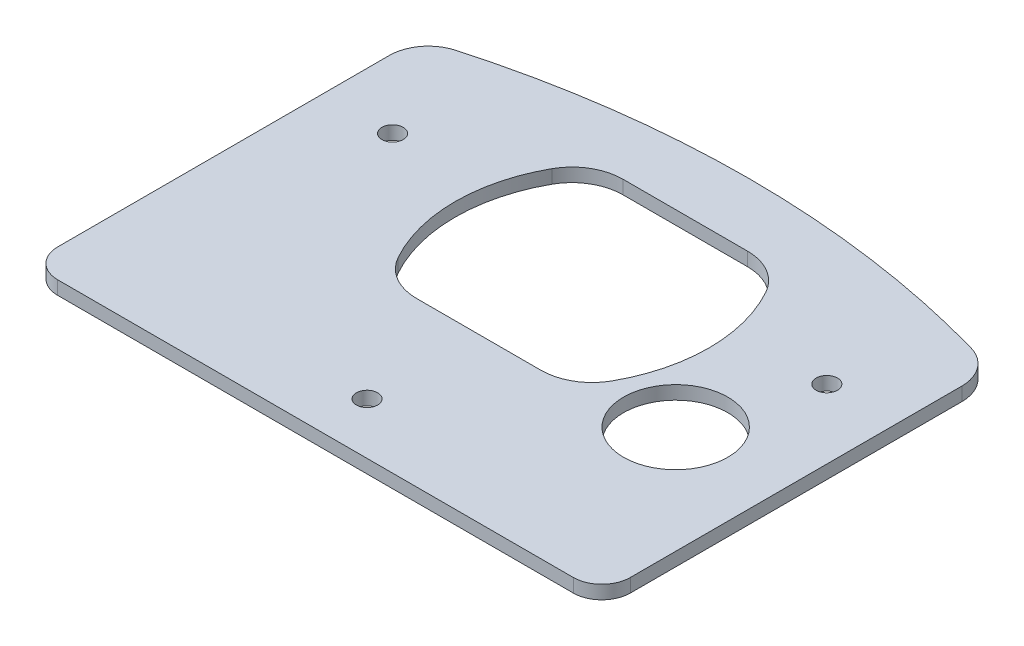
from build123d import *

# Parameters (mm, degrees)
SKETCH1_R           = 2.5
SKETCH1_R_2         = 12.25
BOSS_EXTRUDE1_DEPTH = 3.175
FILLET1_R           = 9.2
FILLET2_R           = 6.7


with BuildPart() as part:
    # Sketch1 → Boss-Extrude1 (new body)
    with BuildSketch(Plane(origin=(0, 0, 0), x_dir=(1, 0, 0), z_dir=(0, 1, 0))):
        with BuildLine():
            Line((-67.25, 0), (67.25, 0))
            Line((67.25, 0), (67.25, 91.408280206))
            ThreePointArc((67.25, 91.408280206), (0, 101.8), (-67.25, 91.408280206))
            Line((-67.25, 91.408280206), (-67.25, 0))
        make_face()
        with Locations(Location((-51, 69.1, 0), (0, 0, 270))):
            Circle(SKETCH1_R, mode=Mode.SUBTRACT)
        with Locations(Location((51, 69.1, 0), (0, 0, 270))):
            Circle(SKETCH1_R, mode=Mode.SUBTRACT)
        with Locations(Location((0, 12.1, 0), (0, 0, 270))):
            Circle(SKETCH1_R, mode=Mode.SUBTRACT)
        with Locations(Location((42, 42.6, 0), (0, 0, 270))):
            Circle(SKETCH1_R_2, mode=Mode.SUBTRACT)
        with BuildLine():
            Line((-14.622204703, 86.85), (14.622204703, 86.85))
            ThreePointArc((14.622204703, 86.85), (20.704967234, 85.194080433), (25.108968848, 80.683333333))
            ThreePointArc((25.108968848, 80.683333333), (29.8, 62.6), (25.108968848, 44.516666667))
            ThreePointArc((25.108968848, 44.516666667), (20.704967234, 40.005919567), (14.622204703, 38.35))
            Line((14.622204703, 38.35), (-14.622204703, 38.35))
            ThreePointArc((-14.622204703, 38.35), (-20.704967234, 40.005919567), (-25.108968848, 44.516666667))
            ThreePointArc((-25.108968848, 44.516666667), (-29.8, 62.6), (-25.108968848, 80.683333333))
            ThreePointArc((-25.108968848, 80.683333333), (-20.704967234, 85.194080433), (-14.622204703, 86.85))
        make_face(mode=Mode.SUBTRACT)
    extrude(amount=BOSS_EXTRUDE1_DEPTH)

    # Fillet1
    fillet1_edges = [part.edges().sort_by_distance(p)[0] for p in [
        (-67.25, 1.5875, -91.408280206),
        (67.25, 1.5875, -91.408280206),
    ]]
    fillet(fillet1_edges, radius=FILLET1_R)

    # Fillet2
    fillet2_edges = [part.edges().sort_by_distance(p)[0] for p in [
        (67.25, 1.5875, 0),
        (-67.25, 1.5875, 0),
    ]]
    fillet(fillet2_edges, radius=FILLET2_R)


solid = part.part
